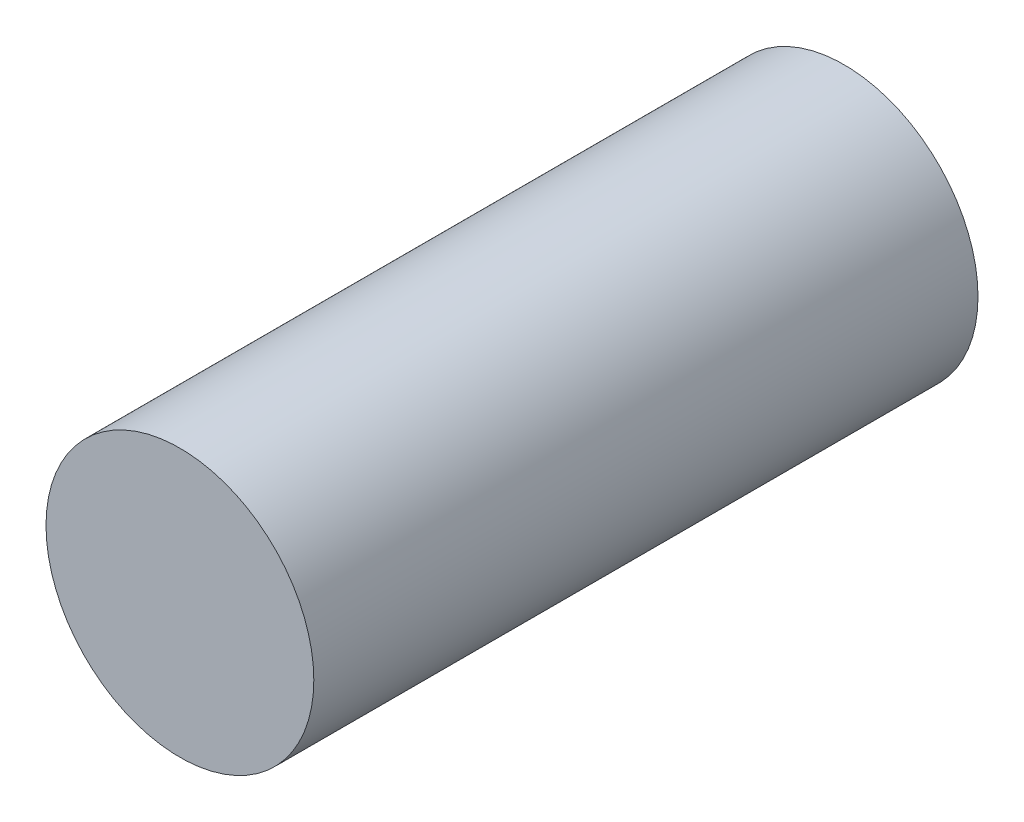
from build123d import *

# Parameters (mm, degrees)
BODY_SKETCH_R = 2.5
BODY_DEPTH    = 12.4


with BuildPart() as part:
    # Body sketch → Body (new body)
    with BuildSketch(Plane.XY):
        with Locations(Location((0, 0, 0), (0, 0, 180))):
            Circle(BODY_SKETCH_R)
    extrude(amount=BODY_DEPTH)


solid = part.part
